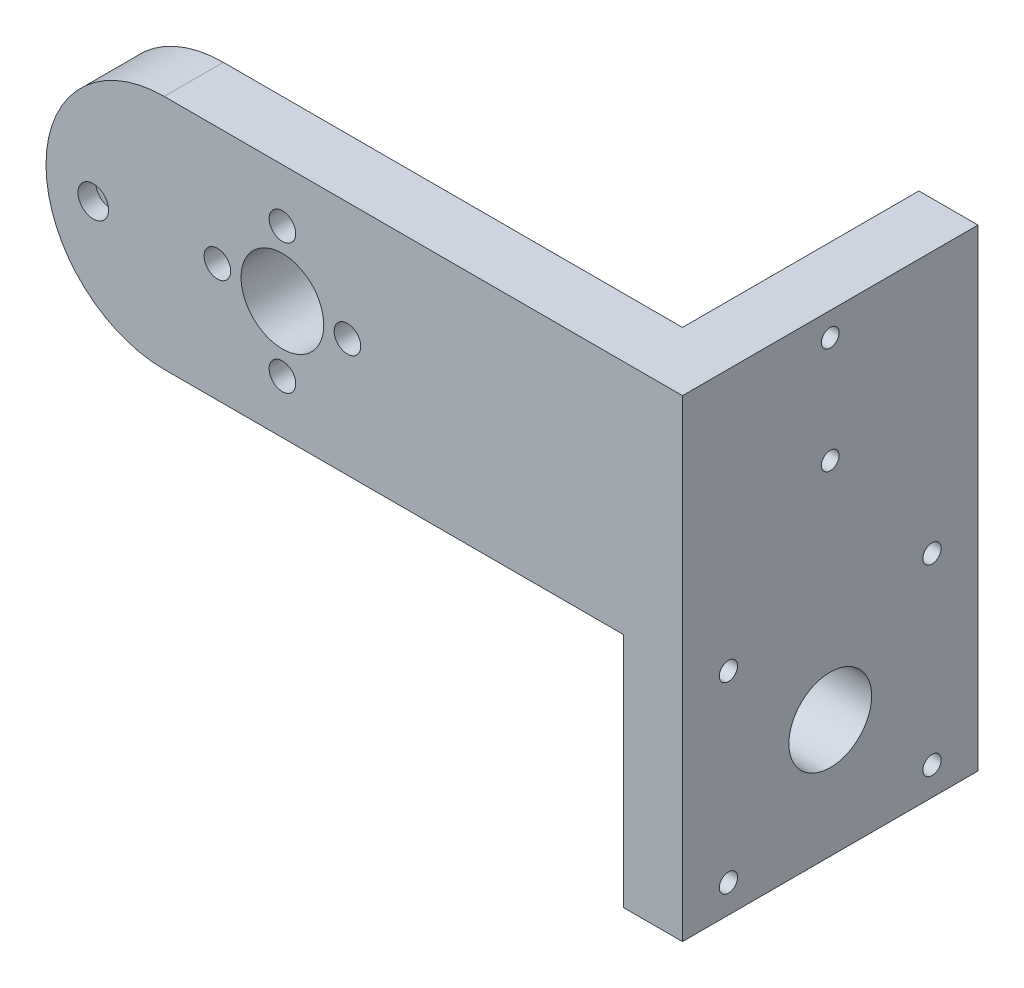
from build123d import *

# Parameters (mm, degrees)
BOSS_EXTRUDE1_DEPTH = 5
SKETCH6_R           = 7
SKETCH6_R_2         = 2.25
CUT_EXTRUDE1_DEPTH  = 91.496055715
BOSS_EXTRUDE2_DEPTH = 10
SKETCH11_R          = 2.59
CUT_EXTRUDE3_DEPTH  = 3
SKETCH16_R          = 1.5
CUT_EXTRUDE6_DEPTH  = 119.415100811
SKETCH24_W          = 10
SKETCH24_H          = 50
BOSS_EXTRUDE8_DEPTH = 40
SKETCH25_R          = 7
CUT_EXTRUDE10_DEPTH = 132.23313644
SKETCH26_R          = 1.55
CUT_EXTRUDE11_DEPTH = 132.23313644


with BuildPart() as part:
    # Sketch3 → Boss-Extrude1 (new, symmetric)
    with BuildSketch(Plane.XY):
        with BuildLine():
            Line((0, 20), (87.69, 20))
            Line((87.69, 20), (87.69, -20))
            Line((87.69, -20), (0, -20))
            ThreePointArc((0, -20), (-20, 0), (0, 20))
        make_face()
    extrude(amount=BOSS_EXTRUDE1_DEPTH, both=True)

    # Sketch6 → Cut-Extrude1 (cut, through all)
    with BuildSketch(Plane.XY.offset(5)):
        with Locations((20, 0)):
            Circle(SKETCH6_R)
        with Locations((20, 11)):
            Circle(SKETCH6_R_2)
        with Locations((31, 0)):
            Circle(SKETCH6_R_2)
        with Locations((20, -11)):
            Circle(SKETCH6_R_2)
        with Locations((9, 0)):
            Circle(SKETCH6_R_2)
    extrude(amount=-CUT_EXTRUDE1_DEPTH, mode=Mode.SUBTRACT)

    # Sketch9 → Boss-Extrude2 (add)
    with BuildSketch(Plane(origin=(87.69, 0, 0), x_dir=(0, 0, -1), z_dir=(1, 0, 0))):
        Polygon((5, 20), (45, 20), (45, -20), (5, -20), (-5, -20), (-5, 20), align=None)
    extrude(amount=-BOSS_EXTRUDE2_DEPTH)

    # Sketch11 → Cut-Extrude3 (cut)
    with BuildSketch(Plane.XY.offset(5)):
        with Locations((-12, -1.375)):
            Circle(SKETCH11_R)
    extrude(amount=-CUT_EXTRUDE3_DEPTH, mode=Mode.SUBTRACT)

    # Sketch16 → Cut-Extrude6 (cut, through all)
    with BuildSketch(Plane(origin=(87.69, 0, 0), x_dir=(0, 0, -1), z_dir=(1, 0, 0))):
        with Locations((20, 16)):
            Circle(SKETCH16_R)
        with Locations((20, -2)):
            Circle(SKETCH16_R)
    extrude(amount=-CUT_EXTRUDE6_DEPTH, mode=Mode.SUBTRACT)

    # Sketch24 → Boss-Extrude8 (add)
    with BuildSketch(Plane(origin=(0, -20, 0), x_dir=(-1, 0, 0), z_dir=(0, -1, 0))):
        with Locations((-82.69, 20)):
            Rectangle(SKETCH24_W, SKETCH24_H)
    extrude(amount=BOSS_EXTRUDE8_DEPTH)

    # Sketch25 → Cut-Extrude10 (cut, through all)
    with BuildSketch(Plane(origin=(87.69, 0, 0), x_dir=(0, 0, -1), z_dir=(1, 0, 0))):
        with Locations((20, -40)):
            Circle(SKETCH25_R)
    extrude(amount=-CUT_EXTRUDE10_DEPTH, mode=Mode.SUBTRACT)

    # Sketch26 → Cut-Extrude11 (cut, through all)
    with BuildSketch(Plane(origin=(87.69, 0, 0), x_dir=(0, 0, -1), z_dir=(1, 0, 0))):
        with Locations((2.78, -24.223522787)):
            Circle(SKETCH26_R)
        with Locations((37.22, -24.223522787)):
            Circle(SKETCH26_R)
        with Locations((37.22, -55.223522787)):
            Circle(SKETCH26_R)
        with Locations((2.78, -55.223522787)):
            Circle(SKETCH26_R)
    extrude(amount=-CUT_EXTRUDE11_DEPTH, mode=Mode.SUBTRACT)


solid = part.part
